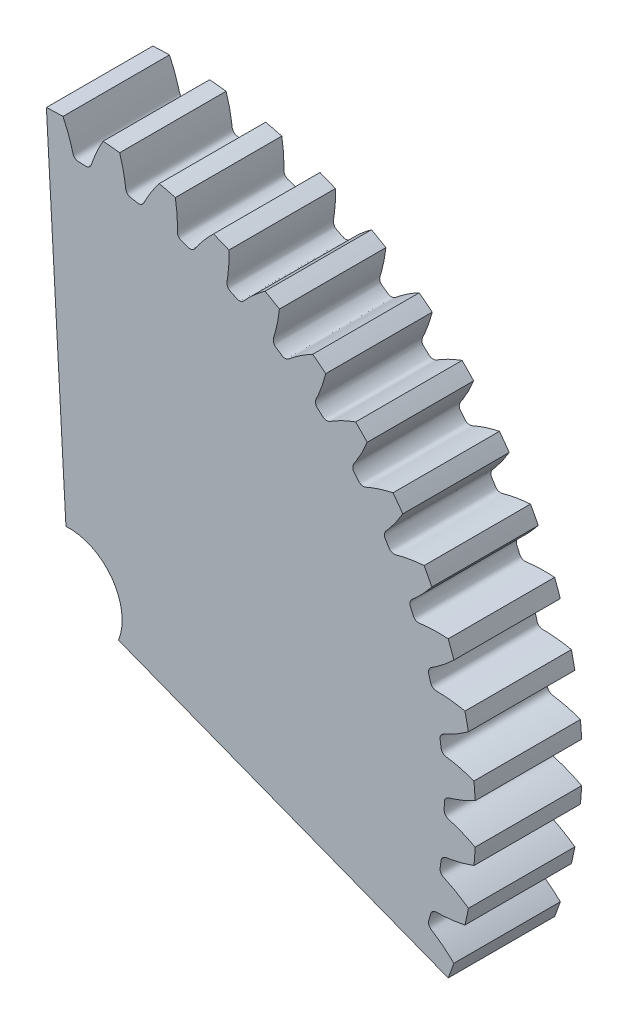
from build123d import *

# Parameters (mm, degrees)
SKETCHREVOLVEGEARTRAX1PINION_W       = 8
SKETCHREVOLVEGEARTRAX1PINION_H       = 30.56494
TOOTHEXTRUDECUTGEARTRAX1PINION_DEPTH = 4
PATTERNGEARTRAX1PINION_COUNT         = 45
BOREREVOLVESKETCH_W                  = 8
BOREREVOLVESKETCH_H                  = 4
SKETCH6_OUTSIDE_W                    = 80.451
SKETCH6_OUTSIDE_H                    = 80.482
CUT_EXTRUDE2_DEPTH                   = 44.957192957


with BuildPart() as part:
    # SketchRevolveGeartrax1Pinion → Geartrax1Pinion (revolve)
    with BuildSketch(Plane(origin=(0, 0, 0), x_dir=(0, 0, -1), z_dir=(1, 0, 0))):
        with Locations((0, 15.28247)):
            Rectangle(SKETCHREVOLVEGEARTRAX1PINION_W, SKETCHREVOLVEGEARTRAX1PINION_H)
    revolve(axis=Axis((0, 0, 0), (0, 0, -1)))

    # SketchToothGeartrax1Pinion → ToothExtrudeCutGeartrax1Pinion (cut, symmetric)
    with BuildSketch(Plane.XY):
        with BuildLine():
            ThreePointArc((30.578839362, 1.536392162), (30.617412, 0), (30.578839362, -1.536392162))
            add(Edge.make_bspline(
                [(30.578839362, -1.536392162), (30.49296751, -1.490858269), (30.365029504, -1.424848187), (30.195142296, -1.340927516), (30.071994112, -1.281850649), (29.951514172, -1.225752523), (29.833754342, -1.172563582), (29.718765234, -1.122213458), (29.606596194, -1.074631023), (29.497295308, -1.029744351), (29.390909329, -0.987480922), (29.287483882, -0.947767009), (29.187062701, -0.910529934), (29.089690273, -0.875690156), (28.995402435, -0.843189383), (28.904259568, -0.812891332), (28.816229501, -0.784931746), (28.697603685, -0.747864271), (28.596482819, -0.722696196), (28.516553541, -0.692884214), (28.486371135, -0.679979122), (28.455116167, -0.664677853), (28.422285613, -0.646050685), (28.387357905, -0.62275535), (28.349987796, -0.5928178), (28.310436268, -0.553511024), (28.270332183, -0.501534595), (28.233960346, -0.434096869), (28.208105053, -0.353210547), (28.197068004, -0.205998991), (28.208672167, 0), (28.197068004, 0.205998991), (28.208105053, 0.353210547), (28.233960346, 0.434096869), (28.270332183, 0.501534595), (28.310436268, 0.553511024), (28.349987796, 0.5928178), (28.387357905, 0.62275535), (28.422285613, 0.646050685), (28.455116167, 0.664677853), (28.486371135, 0.679979122), (28.516553541, 0.692884214), (28.596482819, 0.722696196), (28.697603685, 0.747864271), (28.816229501, 0.784931746), (28.904259568, 0.812891332), (28.995402435, 0.843189383), (29.089690273, 0.875690156), (29.187062701, 0.910529934), (29.287483882, 0.947767009), (29.390909329, 0.987480922), (29.497295308, 1.029744351), (29.606596194, 1.074631023), (29.718765234, 1.122213458), (29.833754342, 1.172563582), (29.951514172, 1.225752523), (30.071994112, 1.281850649), (30.195142296, 1.340927516), (30.365029504, 1.424848187), (30.49296751, 1.490858269), (30.578839362, 1.536392162)],
                knots=[0, 0, 0, 0, 0.047615848, 0.070521093, 0.092824551, 0.114526223, 0.135626109, 0.156124209, 0.176020522, 0.19531505, 0.214007791, 0.232098746, 0.249587914, 0.266475297, 0.282760893, 0.298444703, 0.313526726, 0.328006964, 0.359335477, 0.364462103, 0.369782013, 0.375410388, 0.381501334, 0.388260477, 0.395956749, 0.404922712, 0.415516443, 0.42799778, 0.442292433, 0.45673525, 0.5, 0.54326475, 0.557707567, 0.57200222, 0.584483557, 0.595077288, 0.604043251, 0.611739523, 0.618498666, 0.624589612, 0.630217987, 0.635537897, 0.640664523, 0.671993036, 0.686473274, 0.701555297, 0.717239107, 0.733524703, 0.750412086, 0.767901254, 0.785992209, 0.80468495, 0.823979478, 0.843875791, 0.864373891, 0.885473777, 0.907175449, 0.929478907, 0.952384152, 1, 1, 1, 1], degree=3))
        make_face()
    toothextrudecutgeartrax1pinion = extrude(amount=TOOTHEXTRUDECUTGEARTRAX1PINION_DEPTH, both=True, mode=Mode.SUBTRACT)

    # PatternGeartrax1Pinion: ToothExtrudeCutGeartrax1Pinion ×45 about axis
    patterngeartrax1pinion_axis = Axis((0, 0, 4.4), (0, 0, -1))
    for i in range(1, PATTERNGEARTRAX1PINION_COUNT):
        add(toothextrudecutgeartrax1pinion.rotate(patterngeartrax1pinion_axis, i * 360 / PATTERNGEARTRAX1PINION_COUNT), mode=Mode.SUBTRACT)

    # BoreRevolveSketch → BoreRevolveCut (revolve, cut)
    with BuildSketch(Plane(origin=(0, 0, 0), x_dir=(0, 0, -1), z_dir=(1, 0, 0))):
        with Locations((0, 2)):
            Rectangle(BOREREVOLVESKETCH_W, BOREREVOLVESKETCH_H)
    revolve(axis=Axis((0, 0, 0), (0, 0, -1)), mode=Mode.SUBTRACT)

    # Sketch6 outside → Cut-Extrude2 (cut, through all)
    with BuildSketch(Plane.XY.offset(4)):
        with Locations((-0.0185, 0)):
            Rectangle(SKETCH6_OUTSIDE_W, SKETCH6_OUTSIDE_H)
        with BuildLine():
            Line((0, 0), (-1.689882557, 30.518188907))
            ThreePointArc((-1.689882557, 30.518188907), (24.727555892, 17.965620969), (28.502319997, -11.037812828))
            Line((28.502319997, -11.037812828), (0, 0))
        make_face(mode=Mode.SUBTRACT)
    extrude(amount=-CUT_EXTRUDE2_DEPTH, mode=Mode.SUBTRACT)


solid = part.part
